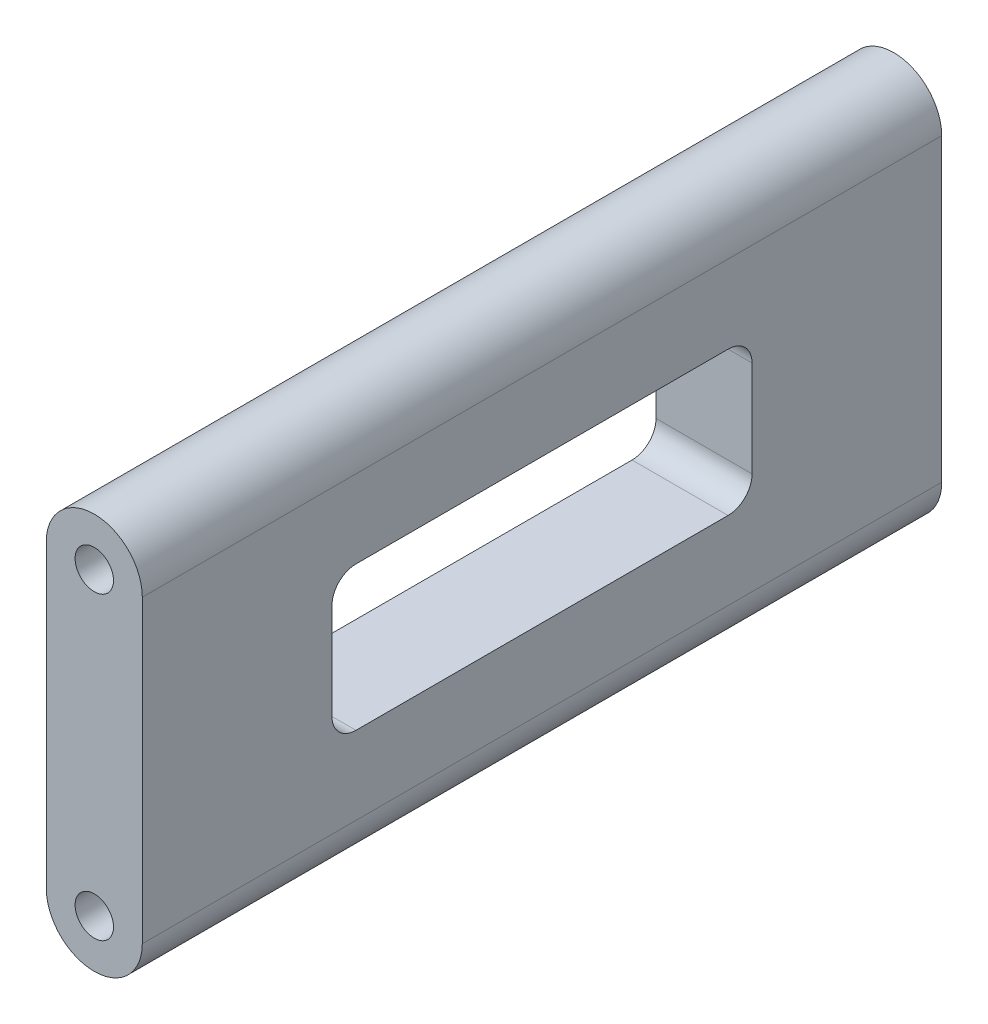
from build123d import *

# Parameters (mm, degrees)
SKETCH_1_R          = 1.6
EXTRUDE_1_DEPTH     = 66.6
CUT_EXTRUDE_1_DEPTH = 70.078288919


with BuildPart() as part:
    # 草图1 → 凸台-拉伸1 (new body)
    with BuildSketch(Plane.XY):
        with BuildLine():
            Line((-4, -12.5), (-4, 12.5))
            ThreePointArc((-4, 12.5), (0, 16.5), (4, 12.5))
            Line((4, 12.5), (4, -12.5))
            ThreePointArc((4, -12.5), (0, -16.5), (-4, -12.5))
        make_face()
        with Locations((0, 12.5)):
            Circle(SKETCH_1_R, mode=Mode.SUBTRACT)
        with Locations((0, -12.5)):
            Circle(SKETCH_1_R, mode=Mode.SUBTRACT)
    extrude(amount=EXTRUDE_1_DEPTH)

    # 草图2 → 切除-拉伸1 (cut, through all)
    with BuildSketch(Plane(origin=(4, 0, 0), x_dir=(0, 0, -1), z_dir=(1, 0, 0))):
        with BuildLine():
            Line((-17.8, -6), (-48.8, -6))
            ThreePointArc((-48.8, -6), (-50.214213562, -5.414213562), (-50.8, -4))
            Line((-50.8, -4), (-50.8, 4))
            ThreePointArc((-50.8, 4), (-50.214213562, 5.414213562), (-48.8, 6))
            Line((-48.8, 6), (-17.8, 6))
            ThreePointArc((-17.8, 6), (-16.385786438, 5.414213562), (-15.8, 4))
            Line((-15.8, 4), (-15.8, -4))
            ThreePointArc((-15.8, -4), (-16.385786438, -5.414213562), (-17.8, -6))
        make_face()
    extrude(amount=-CUT_EXTRUDE_1_DEPTH, mode=Mode.SUBTRACT)


solid = part.part
